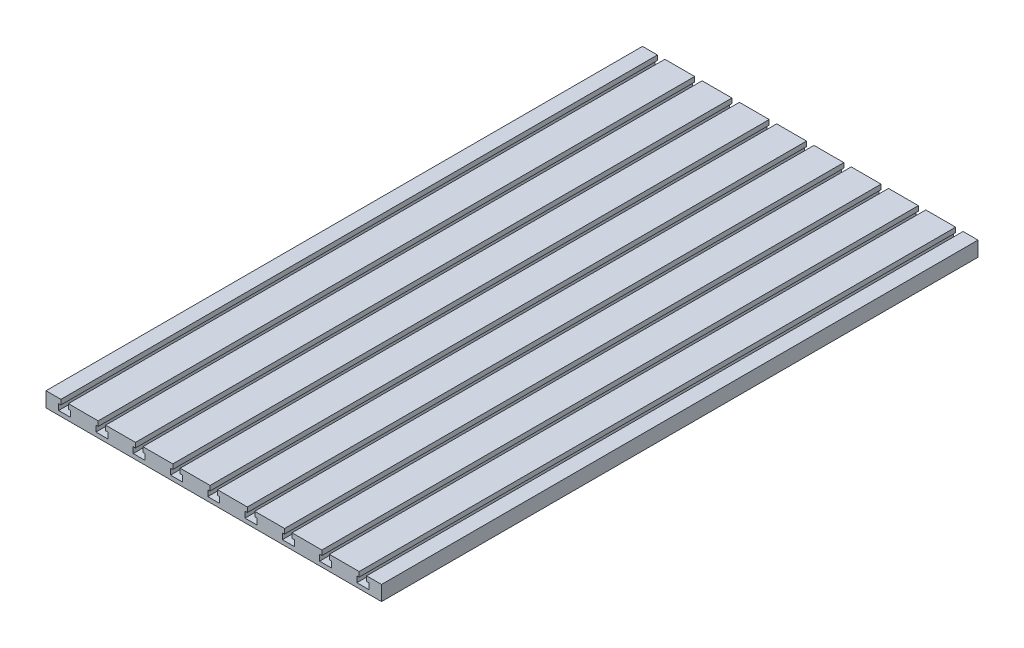
from build123d import *

# Parameters (mm, degrees)
SKETCH1_W           = 450
SKETCH1_H           = 20
BOSS_EXTRUDE1_DEPTH = 800
CUT_EXTRUDE1_DEPTH  = 919.095855562


with BuildPart() as part:
    # Sketch1 → Boss-Extrude1 (new body)
    with BuildSketch(Plane.XY):
        with Locations((-225, 10)):
            Rectangle(SKETCH1_W, SKETCH1_H)
    extrude(amount=BOSS_EXTRUDE1_DEPTH)

    # Sketch2 → Cut-Extrude1 (cut, through all)
    with BuildSketch(Plane.XY.offset(800)):
        Polygon((-430, 20), (-430, 13.5), (-433, 13.5), (-433, 5.5), (-417, 5.5), (-417, 13.5), (-420, 13.5), (-420, 20), align=None)
        Polygon((-380, 20), (-380, 13.5), (-383, 13.5), (-383, 5.5), (-367, 5.5), (-367, 13.5), (-370, 13.5), (-370, 20), align=None)
        Polygon((-330, 20), (-330, 13.5), (-333, 13.5), (-333, 5.5), (-317, 5.5), (-317, 13.5), (-320, 13.5), (-320, 20), align=None)
        Polygon((-280, 20), (-280, 13.5), (-283, 13.5), (-283, 5.5), (-267, 5.5), (-267, 13.5), (-270, 13.5), (-270, 20), align=None)
        Polygon((-230, 20), (-230, 13.5), (-233, 13.5), (-233, 5.5), (-217, 5.5), (-217, 13.5), (-220, 13.5), (-220, 20), align=None)
        Polygon((-180, 20), (-180, 13.5), (-183, 13.5), (-183, 5.5), (-167, 5.5), (-167, 13.5), (-170, 13.5), (-170, 20), align=None)
        Polygon((-130, 20), (-130, 13.5), (-133, 13.5), (-133, 5.5), (-117, 5.5), (-117, 13.5), (-120, 13.5), (-120, 20), align=None)
        Polygon((-80, 20), (-80, 13.5), (-83, 13.5), (-83, 5.5), (-67, 5.5), (-67, 13.5), (-70, 13.5), (-70, 20), align=None)
        Polygon((-30, 20), (-30, 13.5), (-33, 13.5), (-33, 5.5), (-17, 5.5), (-17, 13.5), (-20, 13.5), (-20, 20), align=None)
        Polygon((20, 20), (20, 13.5), (17, 13.5), (17, 5.5), (33, 5.5), (33, 13.5), (30, 13.5), (30, 20), align=None)
    extrude(amount=-CUT_EXTRUDE1_DEPTH, mode=Mode.SUBTRACT)


solid = part.part
